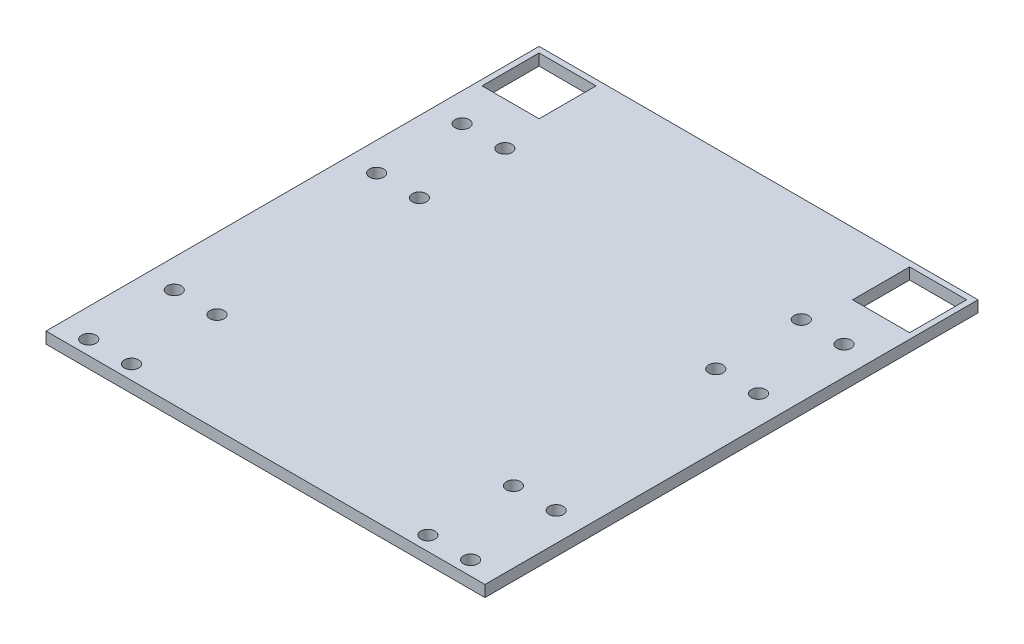
from build123d import *

# Parameters (mm, degrees)
SKETCH1_W           = 154
SKETCH1_H           = 173
BOSS_EXTRUDE1_DEPTH = 4
SKETCH2_R           = 2.5
SKETCH2_W           = 20
SKETCH2_H           = 20
CUT_EXTRUDE1_DEPTH  = 4


with BuildPart() as part:
    # Sketch1 → Boss-Extrude1 (new body)
    with BuildSketch(Plane(origin=(0, 0, 0), x_dir=(1, 0, 0), z_dir=(0, 1, 0))):
        with Locations((-77, -86.5)):
            Rectangle(SKETCH1_W, SKETCH1_H)
    extrude(amount=BOSS_EXTRUDE1_DEPTH)

    # Sketch2 → Cut-Extrude1 (cut)
    with BuildSketch(Plane(origin=(0, 4, 0), x_dir=(1, 0, 0), z_dir=(0, 1, 0))):
        with Locations(Location((-144, -37, 0), (0, 0, 270))):
            Circle(SKETCH2_R)
        with Locations(Location((-129, -37, 0), (0, 0, 270))):
            Circle(SKETCH2_R)
        with Locations(Location((-144, -67, 0), (0, 0, 270))):
            Circle(SKETCH2_R)
        with Locations(Location((-129, -67, 0), (0, 0, 270))):
            Circle(SKETCH2_R)
        with Locations(Location((-25, -67, 0), (0, 0, 90))):
            Circle(SKETCH2_R)
        with Locations(Location((-10, -67, 0), (0, 0, 90))):
            Circle(SKETCH2_R)
        with Locations(Location((-25, -37, 0), (0, 0, 90))):
            Circle(SKETCH2_R)
        with Locations(Location((-10, -37, 0), (0, 0, 90))):
            Circle(SKETCH2_R)
        with Locations(Location((-10, -168, 0), (0, 0, 270))):
            Circle(SKETCH2_R)
        with Locations(Location((-25, -168, 0), (0, 0, 270))):
            Circle(SKETCH2_R)
        with Locations(Location((-10, -138, 0), (0, 0, 270))):
            Circle(SKETCH2_R)
        with Locations(Location((-25, -138, 0), (0, 0, 270))):
            Circle(SKETCH2_R)
        with Locations(Location((-129, -138, 0), (0, 0, 90))):
            Circle(SKETCH2_R)
        with Locations(Location((-144, -138, 0), (0, 0, 90))):
            Circle(SKETCH2_R)
        with Locations(Location((-129, -168, 0), (0, 0, 90))):
            Circle(SKETCH2_R)
        with Locations(Location((-144, -168, 0), (0, 0, 90))):
            Circle(SKETCH2_R)
        with Locations((-142, -12)):
            Rectangle(SKETCH2_W, SKETCH2_H)
        with Locations((-12, -12)):
            Rectangle(SKETCH2_W, SKETCH2_H)
    extrude(amount=-CUT_EXTRUDE1_DEPTH, mode=Mode.SUBTRACT)


solid = part.part
